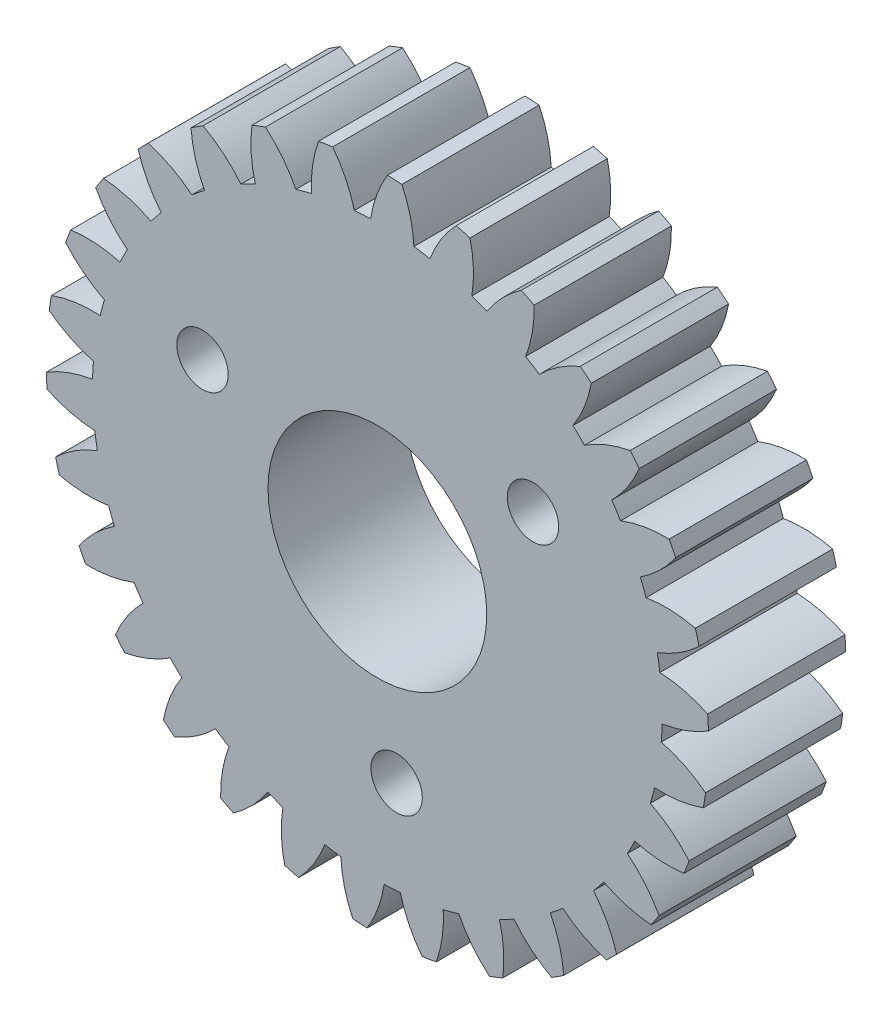
from build123d import *

# Parameters (mm, degrees)
SKETCH1_R           = 53.698142505
BOSS_EXTRUDE1_DEPTH = 10
SKETCH2_R           = 231.808441121
SKETCH2_R_2         = 1.873
SKETCH2_R_3         = 7.96875
CUT_EXTRUDE1_DEPTH  = 283.755864067


with BuildPart() as part:
    # Sketch1 → Boss-Extrude1 (new body)
    with BuildSketch(Plane.XY):
        Circle(SKETCH1_R)
    extrude(amount=BOSS_EXTRUDE1_DEPTH)

    # Sketch2 → Cut-Extrude1 (cut, through all)
    # profile 1 of 5: a face of its own
    with BuildSketch(Plane(origin=(58.963884275, -183.172982664, 105.594585314), x_dir=(1, 0, 0), z_dir=(0, 0, 1))):
        with Locations((-60.717966786, 177.878571708)):
            Circle(SKETCH2_R)
        with BuildLine():
            ThreePointArc((-71.52029693, 160.160962828), (-72.003279968, 158.42292493), (-72.134998016, 156.62384219))
            ThreePointArc((-72.134998016, 156.62384219), (-71.671395573, 156.381257299), (-71.202641594, 156.148782866))
            ThreePointArc((-71.202641594, 156.148782866), (-69.82457501, 157.312819307), (-68.702363121, 158.725153837))
            ThreePointArc((-68.702363121, 158.725153837), (-68.154460107, 158.505844278), (-67.600542079, 158.302204366))
            ThreePointArc((-67.600542079, 158.302204366), (-67.711612381, 156.501728946), (-67.466401739, 154.714574759))
            ThreePointArc((-67.466401739, 154.714574759), (-66.962493887, 154.573679298), (-66.455649155, 154.44374442))
            ThreePointArc((-66.455649155, 154.44374442), (-65.349713416, 155.868860026), (-64.545665409, 157.483652629))
            ThreePointArc((-64.545665409, 157.483652629), (-63.96413837, 157.383050953), (-63.379985662, 157.299027095))
            ThreePointArc((-63.379985662, 157.299027095), (-63.114288922, 155.514803569), (-62.502866472, 153.817685147))
            ThreePointArc((-62.502866472, 153.817685147), (-61.980676402, 153.784636923), (-61.457892463, 153.76292038))
            ThreePointArc((-61.457892463, 153.76292038), (-60.672422269, 155.38683076), (-60.221678901, 157.133507251))
            ThreePointArc((-60.221678901, 157.133507251), (-59.631943358, 157.156010233), (-59.043086246, 157.195274675))
            ThreePointArc((-59.043086246, 157.195274675), (-58.412234687, 155.505282172), (-57.461322524, 153.972371735))
            ThreePointArc((-57.461322524, 153.972371735), (-56.943672448, 154.048615115), (-56.427797469, 154.136066023))
            ThreePointArc((-56.427797469, 154.136066023), (-55.997121636, 155.887798501), (-55.919382554, 157.690020736))
            ThreePointArc((-55.919382554, 157.690020736), (-55.347212781, 157.834644887), (-54.779387146, 157.995481585))
            ThreePointArc((-54.779387146, 157.995481585), (-53.810952009, 156.473580887), (-52.562109558, 155.171873977))
            ThreePointArc((-52.562109558, 155.171873977), (-52.071623267, 155.354076758), (-51.585203461, 155.546873093))
            ThreePointArc((-51.585203461, 155.546873093), (-51.528144589, 157.349868554), (-51.826807365, 159.128870773))
            ThreePointArc((-51.826807365, 159.128870773), (-51.297209926, 159.389295325), (-50.775232473, 159.664674943))
            ThreePointArc((-50.775232473, 159.664674943), (-49.51153902, 158.377380414), (-48.019346688, 157.363767868))
            ThreePointArc((-48.019346688, 157.363767868), (-47.577460788, 157.643966916), (-47.141755033, 157.933682552))
            ThreePointArc((-47.141755033, 157.933682552), (-47.46080687, 159.709141443), (-48.122818507, 161.387172713))
            ThreePointArc((-48.122818507, 161.387172713), (-47.658939351, 161.752015862), (-47.205623, 162.12990299))
            ThreePointArc((-47.205623, 162.12990299), (-45.701900699, 161.133475577), (-44.031574451, 160.452257128))
            ThreePointArc((-44.031574451, 160.452257128), (-43.657601476, 160.818206399), (-43.291652205, 161.192179374))
            ThreePointArc((-43.291652205, 161.192179374), (-43.972870654, 162.862505621), (-44.969298067, 164.366227923))
            ThreePointArc((-44.969298067, 164.366227923), (-44.59141094, 164.819544274), (-44.22656779, 165.28342343))
            ThreePointArc((-44.22656779, 165.28342343), (-42.548536521, 164.621411793), (-40.77307763, 164.302359956))
            ThreePointArc((-40.77307763, 164.302359956), (-40.483361993, 164.738065711), (-40.203162945, 165.179951611))
            ThreePointArc((-40.203162945, 165.179951611), (-41.216775491, 166.672143943), (-42.50407002, 167.935837396))
            ThreePointArc((-42.50407002, 167.935837396), (-42.228690402, 168.457814848), (-41.968265851, 168.987412288))
            ThreePointArc((-41.968265851, 168.987412288), (-40.189263632, 168.688749512), (-38.38626817, 168.745808383))
            ThreePointArc((-38.38626817, 168.745808383), (-38.193471836, 169.23222819), (-38.011269054, 169.72271448))
            ThreePointArc((-38.011269054, 169.72271448), (-39.312975965, 170.971556931), (-40.834876662, 171.939992069))
            ThreePointArc((-40.834876662, 171.939992069), (-40.674039964, 172.507817704), (-40.529415813, 173.079987477))
            ThreePointArc((-40.529415813, 173.079987477), (-38.727193578, 173.157726559), (-36.9754611, 173.588402392))
            ThreePointArc((-36.9754611, 173.588402392), (-36.888010192, 174.10427737), (-36.811766813, 174.621927447))
            ThreePointArc((-36.811766813, 174.621927447), (-38.344677249, 175.57283961), (-40.034669752, 176.203691168))
            ThreePointArc((-40.034669752, 176.203691168), (-39.99540531, 176.79254828), (-39.972902329, 177.382283824))
            ThreePointArc((-39.972902329, 177.382283824), (-38.226225838, 177.833027192), (-36.602315457, 178.618497386))
            ThreePointArc((-36.602315457, 178.618497386), (-36.624032001, 179.141281325), (-36.657080225, 179.663471395))
            ThreePointArc((-36.657080225, 179.663471395), (-38.354198646, 180.274893845), (-40.138422172, 180.540590584))
            ThreePointArc((-40.138422172, 180.540590584), (-40.22244603, 181.124743293), (-40.323047707, 181.706270332))
            ThreePointArc((-40.323047707, 181.706270332), (-38.708255103, 182.510318339), (-37.283139498, 183.616254078))
            ThreePointArc((-37.283139498, 183.616254078), (-37.413074375, 184.12309881), (-37.553969836, 184.627006662))
            ThreePointArc((-37.553969836, 184.627006662), (-39.341124024, 184.872217304), (-41.141599443, 184.761147002))
            ThreePointArc((-41.141599443, 184.761147002), (-41.345239356, 185.315065029), (-41.564548914, 185.862968043))
            ThreePointArc((-41.564548914, 185.862968043), (-40.152214384, 186.985179933), (-38.988177943, 188.363246517))
            ThreePointArc((-38.988177943, 188.363246517), (-39.220652377, 188.832000496), (-39.463237268, 189.295602939))
            ThreePointArc((-39.463237268, 189.295602939), (-41.262320007, 189.163884891), (-43.000357905, 188.680901853))
            ThreePointArc((-43.000357905, 188.680901853), (-43.31471383, 189.180376324), (-43.643146391, 189.670709321))
            ThreePointArc((-43.643146391, 189.670709321), (-42.49499573, 191.062039048), (-41.642912432, 192.652008357))
            ThreePointArc((-41.642912432, 192.652008357), (-41.967766174, 193.062184783), (-42.301438371, 193.465220166))
            ThreePointArc((-42.301438371, 193.465220166), (-44.033821114, 192.962330139), (-45.633460893, 192.128543041))
            ThreePointArc((-45.633460893, 192.128543041), (-46.044793969, 192.551744525), (-46.467995453, 192.963077601))
            ThreePointArc((-46.467995453, 192.963077601), (-45.634208355, 194.56271738), (-45.131318328, 196.295100124))
            ThreePointArc((-45.131318328, 196.295100124), (-45.534353711, 196.628772321), (-45.944530138, 196.953626062))
            ThreePointArc((-45.944530138, 196.953626062), (-47.534499446, 196.101542764), (-48.925829173, 194.953392103))
            ThreePointArc((-48.925829173, 194.953392103), (-49.41616217, 195.281824664), (-49.915636641, 195.596180589))
            ThreePointArc((-49.915636641, 195.596180589), (-49.432653603, 197.334218487), (-49.300935555, 199.133301226))
            ThreePointArc((-49.300935555, 199.133301226), (-49.764537999, 199.375886118), (-50.233291977, 199.608360551))
            ThreePointArc((-50.233291977, 199.608360551), (-51.611358562, 198.44432411), (-52.733570451, 197.03198958))
            ThreePointArc((-52.733570451, 197.03198958), (-53.281473465, 197.251299139), (-53.835391492, 197.454939051))
            ThreePointArc((-53.835391492, 197.454939051), (-53.724321191, 199.255414471), (-53.969531832, 201.042568658))
            ThreePointArc((-53.969531832, 201.042568658), (-54.473439685, 201.183464119), (-54.980284417, 201.313398997))
            ThreePointArc((-54.980284417, 201.313398997), (-56.086220155, 199.888283391), (-56.890268162, 198.273490788))
            ThreePointArc((-56.890268162, 198.273490788), (-57.471795202, 198.374092464), (-58.05594791, 198.458116322))
            ThreePointArc((-58.05594791, 198.458116322), (-58.321644649, 200.242339848), (-58.933067099, 201.93945827))
            ThreePointArc((-58.933067099, 201.93945827), (-59.455257169, 201.972506493), (-59.978041108, 201.994223037))
            ThreePointArc((-59.978041108, 201.994223037), (-60.763511302, 200.370312657), (-61.214254671, 198.623636166))
            ThreePointArc((-61.214254671, 198.623636166), (-61.803990214, 198.601133184), (-62.392847326, 198.561868742))
            ThreePointArc((-62.392847326, 198.561868742), (-63.023698885, 200.251861245), (-63.974611047, 201.784771682))
            ThreePointArc((-63.974611047, 201.784771682), (-64.492261124, 201.708528302), (-65.008136102, 201.621077394))
            ThreePointArc((-65.008136102, 201.621077394), (-65.438811935, 199.869344916), (-65.516551017, 198.067122681))
            ThreePointArc((-65.516551017, 198.067122681), (-66.088720791, 197.92249853), (-66.656546426, 197.761661832))
            ThreePointArc((-66.656546426, 197.761661832), (-67.624981563, 199.28356253), (-68.873824014, 200.58526944))
            ThreePointArc((-68.873824014, 200.58526944), (-69.364310304, 200.403066659), (-69.850730111, 200.210270324))
            ThreePointArc((-69.850730111, 200.210270324), (-69.907788982, 198.407274862), (-69.609126206, 196.628272644))
            ThreePointArc((-69.609126206, 196.628272644), (-70.138723646, 196.367848092), (-70.660701099, 196.092468474))
            ThreePointArc((-70.660701099, 196.092468474), (-71.924394552, 197.379763003), (-73.416586884, 198.393375549))
            ThreePointArc((-73.416586884, 198.393375549), (-73.858472784, 198.113176501), (-74.294178538, 197.823460865))
            ThreePointArc((-74.294178538, 197.823460865), (-73.975126701, 196.048001974), (-73.313115065, 194.369970704))
            ThreePointArc((-73.313115065, 194.369970704), (-73.77699422, 194.005127555), (-74.230310571, 193.627240427))
            ThreePointArc((-74.230310571, 193.627240427), (-75.734032873, 194.62366784), (-77.40435912, 195.304886289))
            ThreePointArc((-77.40435912, 195.304886289), (-77.778332095, 194.938937018), (-78.144281366, 194.564964043))
            ThreePointArc((-78.144281366, 194.564964043), (-77.463062917, 192.894637796), (-76.466635505, 191.390915494))
            ThreePointArc((-76.466635505, 191.390915494), (-76.844522632, 190.937599143), (-77.209365781, 190.473719987))
            ThreePointArc((-77.209365781, 190.473719987), (-78.887397051, 191.135731624), (-80.662855942, 191.454783461))
            ThreePointArc((-80.662855942, 191.454783461), (-80.952571579, 191.019077706), (-81.232770626, 190.577191806))
            ThreePointArc((-81.232770626, 190.577191806), (-80.21915808, 189.084999474), (-78.931863551, 187.821306021))
            ThreePointArc((-78.931863551, 187.821306021), (-79.207243169, 187.299328569), (-79.467667721, 186.769731129))
            ThreePointArc((-79.467667721, 186.769731129), (-81.24666994, 187.068393905), (-83.049665401, 187.011335034))
            ThreePointArc((-83.049665401, 187.011335034), (-83.242461736, 186.524915227), (-83.424664517, 186.034428937))
            ThreePointArc((-83.424664517, 186.034428937), (-82.122957607, 184.785586485), (-80.601056909, 183.817151348))
            ThreePointArc((-80.601056909, 183.817151348), (-80.761893607, 183.249325713), (-80.906517758, 182.67715594))
            ThreePointArc((-80.906517758, 182.67715594), (-82.708739993, 182.599416858), (-84.460472471, 182.168741025))
            ThreePointArc((-84.460472471, 182.168741025), (-84.547923379, 181.652866046), (-84.624166759, 181.13521597))
            ThreePointArc((-84.624166759, 181.13521597), (-83.091256322, 180.184303807), (-81.401263819, 179.553452249))
            ThreePointArc((-81.401263819, 179.553452249), (-81.440528261, 178.964595136), (-81.463031243, 178.374859593))
            ThreePointArc((-81.463031243, 178.374859593), (-83.209707734, 177.924116225), (-84.833618114, 177.138646031))
            ThreePointArc((-84.833618114, 177.138646031), (-84.811901571, 176.615862092), (-84.778853347, 176.093672022))
            ThreePointArc((-84.778853347, 176.093672022), (-83.081734925, 175.482249572), (-81.297511399, 175.216552832))
            ThreePointArc((-81.297511399, 175.216552832), (-81.213487541, 174.632400124), (-81.112885865, 174.050873085))
            ThreePointArc((-81.112885865, 174.050873085), (-82.727678468, 173.246825078), (-84.152794074, 172.140889339))
            ThreePointArc((-84.152794074, 172.140889339), (-84.022859197, 171.634044607), (-83.881963735, 171.130136755))
            ThreePointArc((-83.881963735, 171.130136755), (-82.094809548, 170.884926113), (-80.294334128, 170.995996415))
            ThreePointArc((-80.294334128, 170.995996415), (-80.090694216, 170.442078387), (-79.871384657, 169.894175374))
            ThreePointArc((-79.871384657, 169.894175374), (-81.283719187, 168.771963484), (-82.447755629, 167.3938969))
            ThreePointArc((-82.447755629, 167.3938969), (-82.215281195, 166.925142921), (-81.972696304, 166.461540478))
            ThreePointArc((-81.972696304, 166.461540478), (-80.173613564, 166.593258526), (-78.435575666, 167.076241564))
            ThreePointArc((-78.435575666, 167.076241564), (-78.121219741, 166.576767093), (-77.792787181, 166.086434096))
            ThreePointArc((-77.792787181, 166.086434096), (-78.940937841, 164.695104368), (-79.79302114, 163.10513506))
            ThreePointArc((-79.79302114, 163.10513506), (-79.468167398, 162.694958634), (-79.134495201, 162.291923251))
            ThreePointArc((-79.134495201, 162.291923251), (-77.402112458, 162.794813278), (-75.802472678, 163.628600376))
            ThreePointArc((-75.802472678, 163.628600376), (-75.391139602, 163.205398892), (-74.967938119, 162.794065816))
            ThreePointArc((-74.967938119, 162.794065816), (-75.801725216, 161.194426037), (-76.304615243, 159.462043293))
            ThreePointArc((-76.304615243, 159.462043293), (-75.901579861, 159.128371096), (-75.491403434, 158.803517355))
            ThreePointArc((-75.491403434, 158.803517355), (-73.901434126, 159.655600653), (-72.510104399, 160.803751314))
            ThreePointArc((-72.510104399, 160.803751314), (-72.019771401, 160.475318753), (-71.52029693, 160.160962828))
        make_face(mode=Mode.SUBTRACT)
    # profile 2 of 5: a face of its own
    with BuildSketch(Plane(origin=(58.963884275, -183.172982664, 105.594585314), x_dir=(1, 0, 0), z_dir=(0, 0, 1))):
        with Locations((-73.454863948, 183.614199593)):
            Circle(SKETCH2_R_2)
    # profile 3 of 5: a face of its own
    with BuildSketch(Plane(origin=(58.963884275, -183.172982664, 105.594585314), x_dir=(1, 0, 0), z_dir=(0, 0, 1))):
        with Locations((-59.31671766, 163.980281258)):
            Circle(SKETCH2_R_2)
    # profile 4 of 5: a face of its own
    with BuildSketch(Plane(origin=(58.963884275, -183.172982664, 105.594585314), x_dir=(1, 0, 0), z_dir=(0, 0, 1))):
        with Locations((-49.38231875, 186.041234274)):
            Circle(SKETCH2_R_2)
    # profile 5 of 5: a face of its own
    with BuildSketch(Plane(origin=(58.963884275, -183.172982664, 105.594585314), x_dir=(1, 0, 0), z_dir=(0, 0, 1))):
        with Locations((-60.717966786, 177.878571708)):
            Circle(SKETCH2_R_3)
    extrude(amount=-CUT_EXTRUDE1_DEPTH, mode=Mode.SUBTRACT)


solid = part.part
